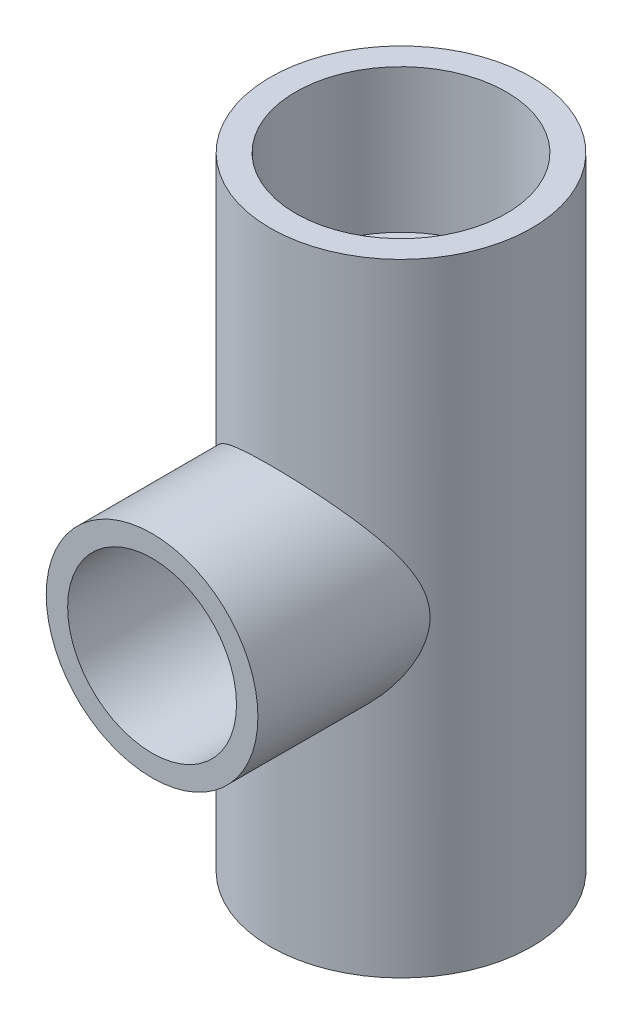
from build123d import *

# Parameters (mm, degrees)
SKETCH1_R           = 656.5
BOSS_EXTRUDE1_DEPTH = 3125
SKETCH2_R           = 531.5
BOSS_EXTRUDE2_DEPTH = 1250
SKETCH3_R           = 424
CUT_EXTRUDE1_DEPTH  = 690
SKETCH4_R           = 311
CUT_EXTRUDE2_DEPTH  = 560
SKETCH5_R           = 529
CUT_EXTRUDE3_DEPTH  = 720
SKETCH6_R           = 412
CUT_EXTRUDE4_DEPTH  = 2789.820046339
CUT_EXTRUDE5_START  = -720
SKETCH7_R           = 529
CUT_EXTRUDE5_DEPTH  = 720


with BuildPart() as part:
    # Sketch1 → Boss-Extrude1 (new body)
    with BuildSketch(Plane(origin=(0, 0, 0), x_dir=(1, 0, 0), z_dir=(0, 1, 0))):
        with Locations(Location((0, 0, 0), (0, 0, 270))):
            Circle(SKETCH1_R)
    extrude(amount=BOSS_EXTRUDE1_DEPTH)

    # Sketch2 → Boss-Extrude2 (add)
    with BuildSketch(Plane.XY):
        with Locations(Location((0, 1562.5, 0), (0, 0, 180))):
            Circle(SKETCH2_R)
    extrude(amount=BOSS_EXTRUDE2_DEPTH)

    # Sketch3 → Cut-Extrude1 (cut)
    with BuildSketch(Plane.XY.offset(1250)):
        with Locations((0, 1562.5)):
            Circle(SKETCH3_R)
    extrude(amount=-CUT_EXTRUDE1_DEPTH, mode=Mode.SUBTRACT)

    # Sketch4 → Cut-Extrude2 (cut)
    with BuildSketch(Plane.XY.offset(560)):
        with Locations((0, 1562.5)):
            Circle(SKETCH4_R)
    extrude(amount=-CUT_EXTRUDE2_DEPTH, mode=Mode.SUBTRACT)

    # Sketch5 → Cut-Extrude3 (cut)
    with BuildSketch(Plane.XZ):
        with Locations(Location((0, 0, 0), (0, 0, 270))):
            Circle(SKETCH5_R)
    extrude(amount=-CUT_EXTRUDE3_DEPTH, mode=Mode.SUBTRACT)

    # Sketch6 → Cut-Extrude4 (cut, through all)
    with BuildSketch(Plane.XZ.offset(-720)):
        with Locations(Location((0, 0, 0), (0, 0, 270))):
            Circle(SKETCH6_R)
    extrude(amount=-CUT_EXTRUDE4_DEPTH, mode=Mode.SUBTRACT)

    # Sketch7 → Cut-Extrude5 (cut)
    with BuildSketch(Plane(origin=(0, 3125, 0), x_dir=(1, 0, 0), z_dir=(0, 1, 0)).offset(CUT_EXTRUDE5_START)):
        with Locations(Location((0, 0, 0), (0, 0, 90))):
            Circle(SKETCH7_R)
    extrude(amount=CUT_EXTRUDE5_DEPTH, mode=Mode.SUBTRACT)


solid = part.part
